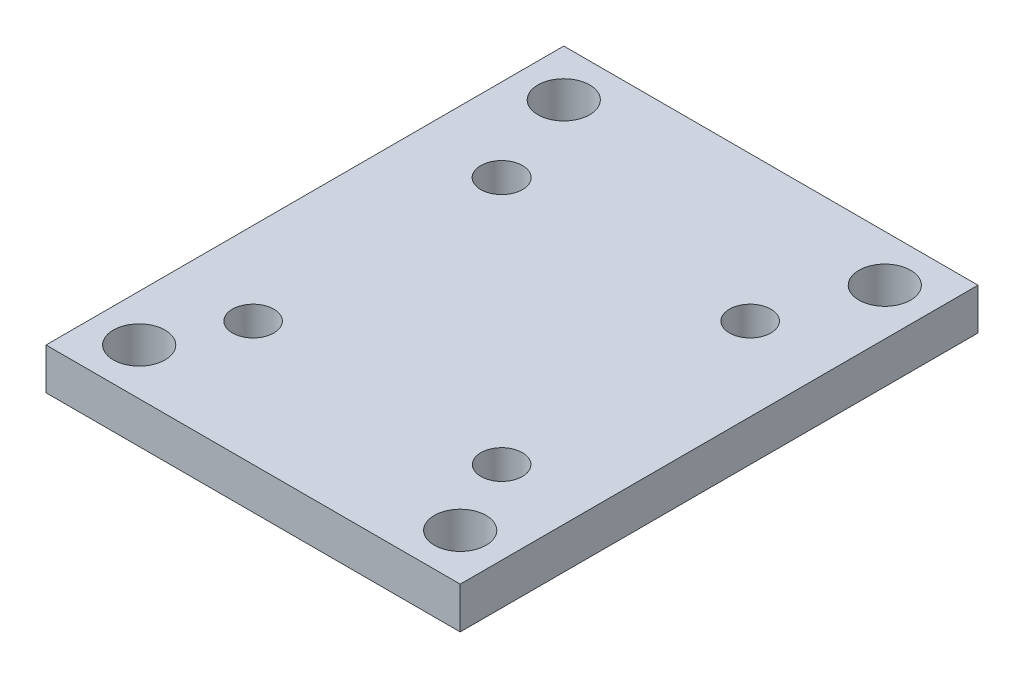
from build123d import *

# Parameters (mm, degrees)
SKETCH1_W           = 25.4
SKETCH1_H           = 31.75
SKETCH1_R           = 1.5875
BOSS_EXTRUDE1_DEPTH = 2.54
SKETCH2_R           = 1.27966848
SKETCH2_R_2         = 1.27
CUT_EXTRUDE1_DEPTH  = 41.739097928


with BuildPart() as part:
    # Sketch1 → Boss-Extrude1 (new body)
    with BuildSketch(Plane(origin=(0, 0, 0), x_dir=(1, 0, 0), z_dir=(0, 1, 0))):
        with Locations((12.7, 15.875)):
            Rectangle(SKETCH1_W, SKETCH1_H)
        with Locations(Location((2.8575, 28.8925, 0), (0, 0, 270))):
            Circle(SKETCH1_R, mode=Mode.SUBTRACT)
        with Locations(Location((22.5425, 28.8925, 0), (0, 0, 270))):
            Circle(SKETCH1_R, mode=Mode.SUBTRACT)
        with Locations(Location((2.8575, 2.8575, 0), (0, 0, 270))):
            Circle(SKETCH1_R, mode=Mode.SUBTRACT)
        with Locations(Location((22.5425, 2.8575, 0), (0, 0, 270))):
            Circle(SKETCH1_R, mode=Mode.SUBTRACT)
    extrude(amount=BOSS_EXTRUDE1_DEPTH)

    # Sketch2 → Cut-Extrude1 (cut, through all)
    with BuildSketch(Plane(origin=(0, 2.54, 0), x_dir=(1, 0, 0), z_dir=(0, 1, 0))):
        with Locations(Location((5.08, 22.86, 0), (0, 0, 270))):
            Circle(SKETCH2_R)
        with Locations(Location((20.32, 22.86, 0), (0, 0, 270))):
            Circle(SKETCH2_R_2)
        with Locations(Location((5.08, 7.62, 0), (0, 0, 270))):
            Circle(SKETCH2_R_2)
        with Locations(Location((20.32, 7.62, 0), (0, 0, 270))):
            Circle(SKETCH2_R_2)
    extrude(amount=-CUT_EXTRUDE1_DEPTH, mode=Mode.SUBTRACT)


solid = part.part
